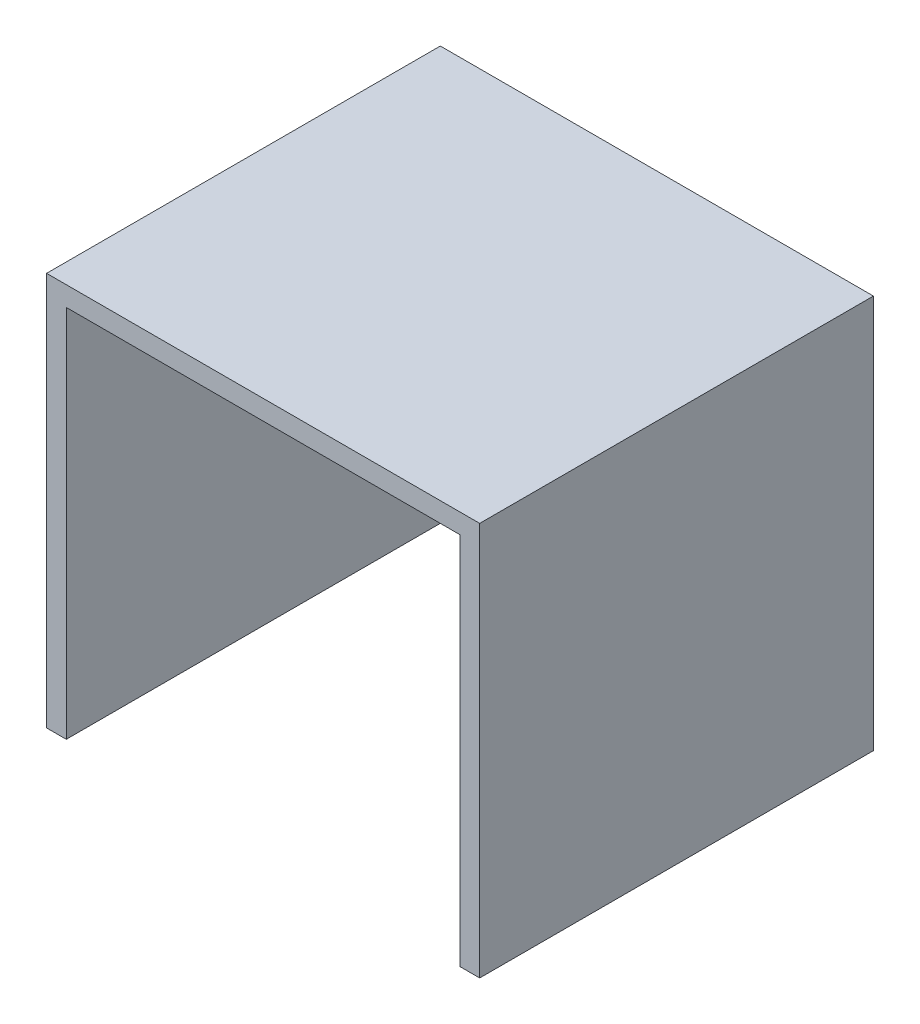
from build123d import *

# Parameters (mm, degrees)
BOSS_EXTRUDE1_DEPTH = 40


with BuildPart() as part:
    # Sketch1 → Boss-Extrude1 (new body)
    with BuildSketch(Plane.XY):
        Polygon((2, -2), (2, -40), (0, -40), (0, 0), (44, 0), (44, -40), (42, -40), (42, -2), align=None)
    extrude(amount=BOSS_EXTRUDE1_DEPTH)


solid = part.part
